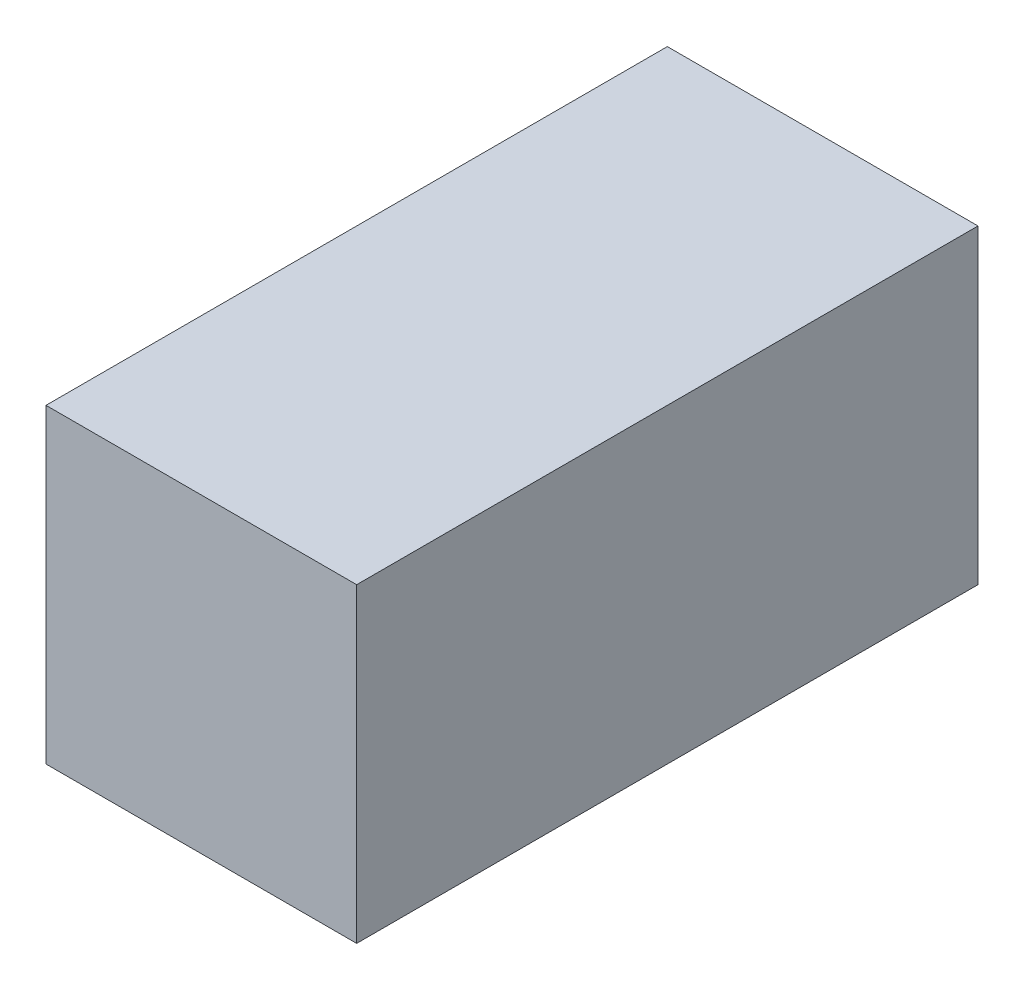
from build123d import *

# Parameters (mm, degrees)
SKETCH1_W      = 25.4
SKETCH1_H      = 25.4
EXTRUDE1_DEPTH = 50.8


with BuildPart() as part:
    # Sketch1 → Extrude1 (new body)
    with BuildSketch(Plane.XY):
        with Locations((12.7, 12.7)):
            Rectangle(SKETCH1_W, SKETCH1_H)
    extrude(amount=EXTRUDE1_DEPTH)


solid = part.part
